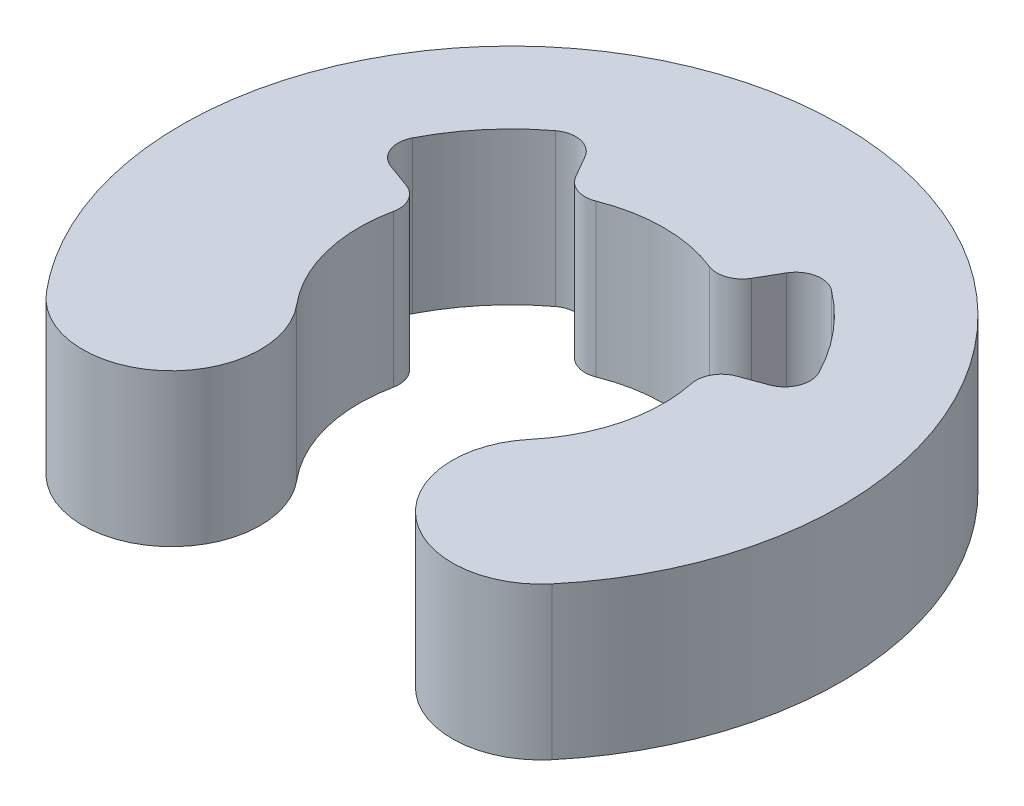
from build123d import *

# Parameters (mm, degrees)
RESSALTO_EXTRUS_O1_DEPTH = 3


with BuildPart() as part:
    # Esboço1 → Ressalto-extrusão1 (new body)
    with BuildSketch(Plane(origin=(0, 0, 0), x_dir=(1, 0, 0), z_dir=(0, 1, 0))):
        with BuildLine():
            Line((-3.729289475, 1.357350364), (-3.255190725, 1.184792531))
            ThreePointArc((-3.255190725, 1.184792531), (-2.989342722, 0.958164276), (-2.93674354, 0.612811046))
            ThreePointArc((-2.93674354, 0.612811046), (-2.909531771, -0.731180466), (-2.298133329, -1.928362829))
            ThreePointArc((-2.298133329, -1.928362829), (-2.513832788, -4.393818921), (-4.97928888, -4.178119463))
            ThreePointArc((-4.97928888, -4.178119463), (0, 6.5), (4.97928888, -4.178119463))
            ThreePointArc((4.97928888, -4.178119463), (2.513832788, -4.393818921), (2.298133329, -1.928362829))
            ThreePointArc((2.298133329, -1.928362829), (2.909531771, -0.731180466), (2.93674354, 0.612811046))
            ThreePointArc((2.93674354, 0.612811046), (2.989342722, 0.958164276), (3.255190725, 1.184792531))
            Line((3.255190725, 1.184792531), (3.729289475, 1.357350364))
            ThreePointArc((3.729289475, 1.357350364), (4.023776667, 1.644680105), (4.003064329, 2.055596259))
            ThreePointArc((4.003064329, 2.055596259), (3.447199994, 2.892544244), (2.719491958, 3.585298243))
            ThreePointArc((2.719491958, 3.585298243), (2.318415204, 3.677050755), (1.984313483, 3.436931771))
            Line((1.984313483, 3.436931771), (1.732050808, 3))
            ThreePointArc((1.732050808, 3), (1.462701523, 2.777544409), (1.113461233, 2.785714286))
            ThreePointArc((1.113461233, 2.785714286), (0, 3), (-1.113461233, 2.785714286))
            ThreePointArc((-1.113461233, 2.785714286), (-1.462701523, 2.777544409), (-1.732050808, 3))
            Line((-1.732050808, 3), (-1.984313483, 3.436931771))
            ThreePointArc((-1.984313483, 3.436931771), (-2.318415204, 3.677050755), (-2.719491958, 3.585298243))
            ThreePointArc((-2.719491958, 3.585298243), (-3.447199994, 2.892544244), (-4.003064329, 2.055596259))
            ThreePointArc((-4.003064329, 2.055596259), (-4.023776667, 1.644680105), (-3.729289475, 1.357350364))
        make_face()
    extrude(amount=RESSALTO_EXTRUS_O1_DEPTH)


solid = part.part
